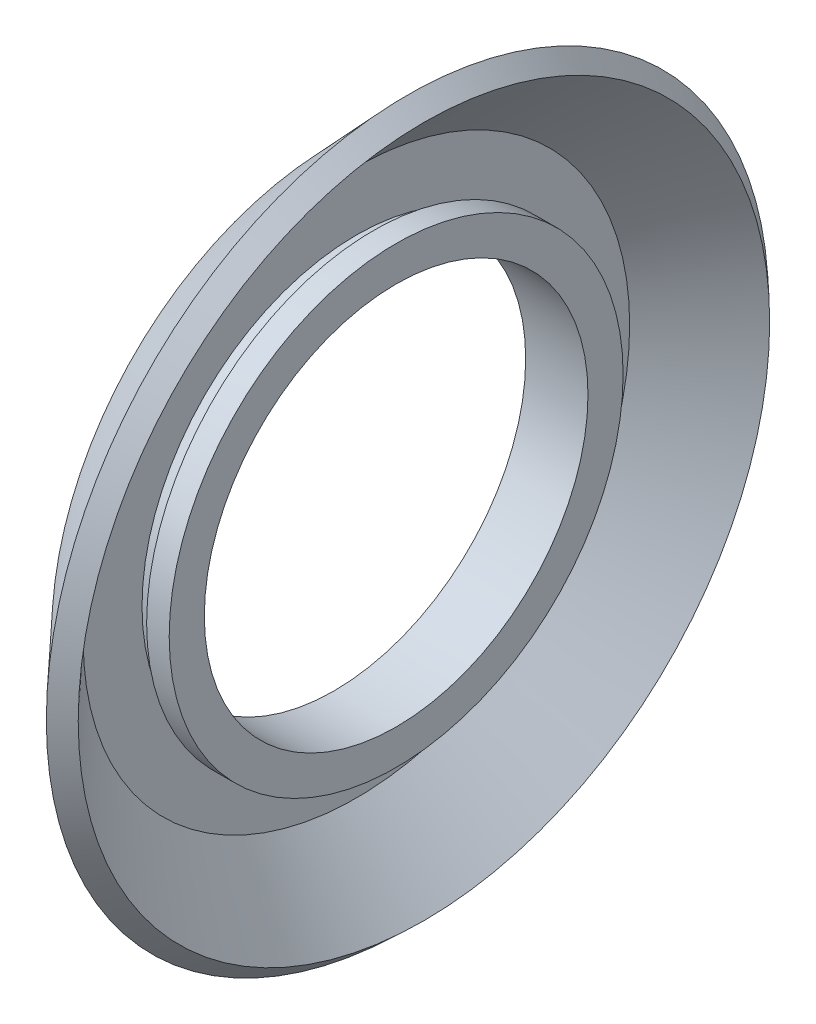
from build123d import *


with BuildPart() as part:
    # Esquisse1 → Révol.-Mince2 (revolve)
    with BuildSketch(Plane.XY, mode=Mode.PRIVATE) as r_vol_mince2_sk:
        Polygon((2.76, 10.056278032), (2.76, 8.5), (0, 8.5), (0, 12.5), (3.26, 16), (3.991750138, 15.318427014), (1, 12.106425332), (1, 9.5), (1.76, 9.5), (1.76, 10.056278032), align=None)
    revolve(r_vol_mince2_sk.sketch.rotate(Axis((-7.892655367, 0, 0), (1, 0, 0)), 90), axis=Axis((-7.892655367, 0, 0), (1, 0, 0)))


solid = part.part
